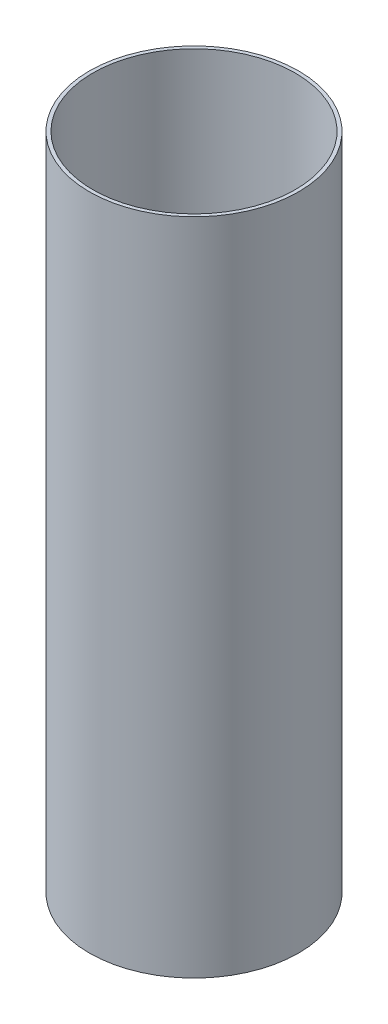
from build123d import *

# Parameters (mm, degrees)
SKETCH1_W = 3.175
SKETCH1_H = 600


with BuildPart() as part:
    # Sketch1 → Revolve1 (revolve)
    with BuildSketch(Plane.XY, mode=Mode.PRIVATE) as revolve1_sk:
        with Locations((93.6625, 300)):
            Rectangle(SKETCH1_W, SKETCH1_H)
    revolve(revolve1_sk.sketch.rotate(Axis((0, 0, 0), (0, 1, 0)), 90), axis=Axis((0, 0, 0), (0, 1, 0)))


solid = part.part
